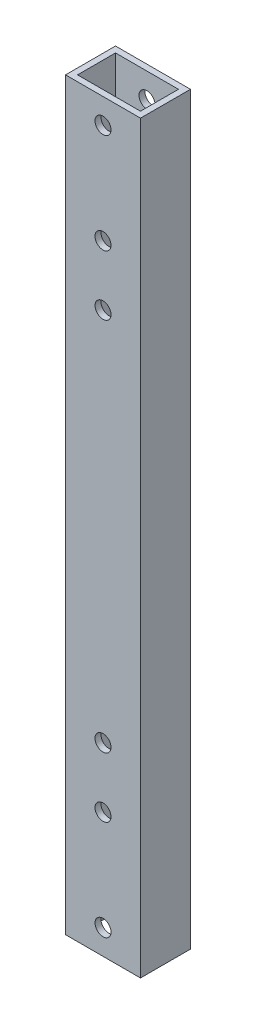
from build123d import *

# Parameters (mm, degrees)
SKETCH_1_W          = 15
SKETCH_1_H          = 10
SKETCH_1_W_2        = 12.6
SKETCH_1_H_2        = 7.6
EXTRUDE_1_DEPTH     = 74.51
SKETCH_3_R          = 1.6
CUT_EXTRUDE_1_DEPTH = 10
SKETCH_4_R          = 1.6
CUT_EXTRUDE_2_DEPTH = 10


with BuildPart() as part:
    # ｽｹｯﾁ1 → ﾎﾞｽ - 押し出し1 (new, symmetric)
    with BuildSketch(Plane(origin=(0, 0, 0), x_dir=(1, 0, 0), z_dir=(0, 1, 0))):
        Rectangle(SKETCH_1_W, SKETCH_1_H)
        Rectangle(SKETCH_1_W_2, SKETCH_1_H_2, mode=Mode.SUBTRACT)
    extrude(amount=EXTRUDE_1_DEPTH, both=True)

    # ｽｹｯﾁ3 → ｶｯﾄ - 押し出し1 (cut)
    with BuildSketch(Plane.XY.offset(5)):
        with Locations((0, 49.51)):
            Circle(SKETCH_3_R)
        with Locations((0, 69.51)):
            Circle(SKETCH_3_R)
    cut_extrude_1 = extrude(amount=-CUT_EXTRUDE_1_DEPTH, mode=Mode.SUBTRACT)

    # ﾐﾗｰ1: ｶｯﾄ - 押し出し1 across plane
    add(cut_extrude_1.mirror(Plane.ZX), mode=Mode.SUBTRACT)

    # ｽｹｯﾁ4 → ｶｯﾄ - 押し出し2 (cut)
    with BuildSketch(Plane(origin=(0, 0, -5), x_dir=(-1, 0, 0), z_dir=(0, 0, -1))):
        with Locations((0, 37.5)):
            Circle(SKETCH_4_R)
        with Locations(Location((0, -37.5, 0), (0, 0, 180))):
            Circle(SKETCH_4_R)
    extrude(amount=-CUT_EXTRUDE_2_DEPTH, mode=Mode.SUBTRACT)


solid = part.part
